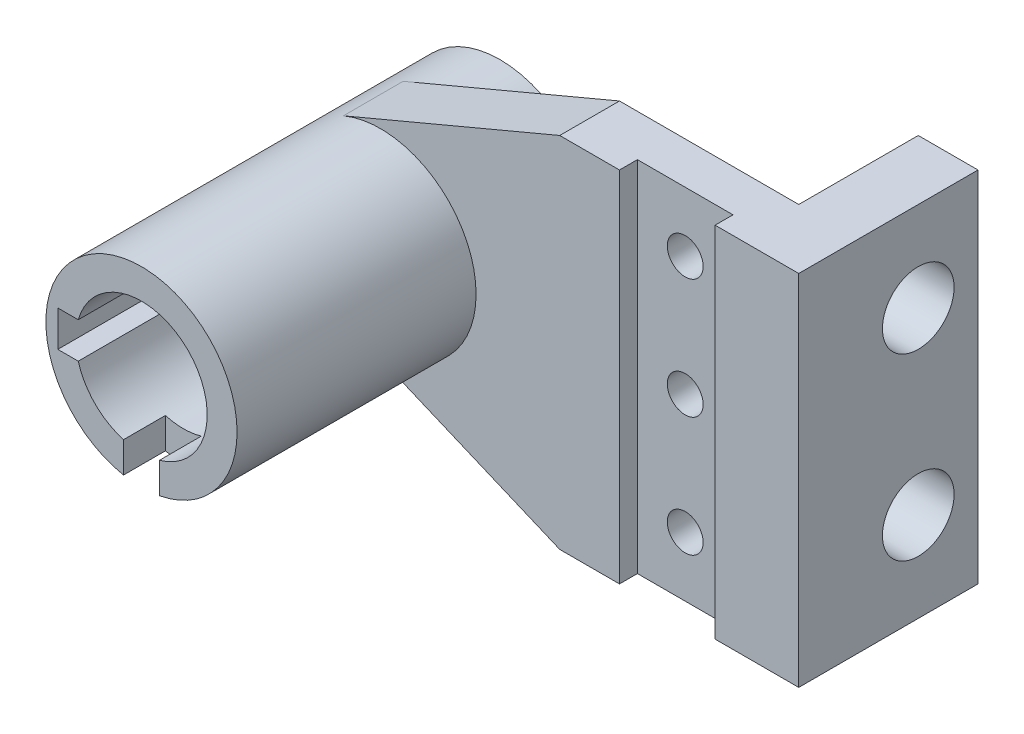
from build123d import *

# Parameters (mm, degrees)
SKETCH2_R                = 3
BOSS_EXTRUDE1_DEPTH      = 10
SKETCH2_5_R              = 3
CUT_EXTRUDE1_DEPTH       = 3
BOSS_EXTRUDE2_DEPTH      = 40
BOSS_EXTRUDE2_DEPTH_BACK = 20
SKETCH3_W                = 30
SKETCH3_H                = 20
SKETCH3_R                = 6
BOSS_EXTRUDE3_DEPTH      = 10
CUT_EXTRUDE2_START       = -7
CUT_EXTRUDE2_DEPTH       = 7


with BuildPart() as part:
    # Sketch2 → Boss-Extrude1 (new body)
    with BuildSketch(Plane(origin=(0, 0, 0), x_dir=(0, 1, 0), z_dir=(0, 0, 1))):
        with BuildLine():
            ThreePointArc((0, -16), (-13.330167524, -8.849103559), (-14.745004109, 6.211670776))
            Line((-14.745004109, 6.211670776), (-30, -30))
            Line((-30, -30), (-30, -70))
            Line((-30, -70), (0, -70))
            Line((0, -70), (0, -51))
            ThreePointArc((0, -51), (-3, -48), (0, -45))
            Line((0, -45), (0, -16))
        make_face()
        with Locations((-20, -48)):
            Circle(SKETCH2_R, mode=Mode.SUBTRACT)
    extrude(amount=-BOSS_EXTRUDE1_DEPTH)

    # Sketch2<5> → Cut-Extrude1 (cut)
    with BuildSketch(Plane(origin=(0, 0, 0), x_dir=(0, 1, 0), z_dir=(0, 0, 1))):
        with BuildLine():
            Line((0, -40), (-30, -40))
            Line((-30, -40), (-30, -56))
            Line((-30, -56), (0, -56))
            Line((0, -56), (0, -51))
            ThreePointArc((0, -51), (-3, -48), (0, -45))
            Line((0, -45), (0, -40))
        make_face()
        with Locations((-20, -48)):
            Circle(SKETCH2_5_R, mode=Mode.SUBTRACT)
    extrude(amount=-CUT_EXTRUDE1_DEPTH, mode=Mode.SUBTRACT)

    # Sketch2<6> → Boss-Extrude2 (add, two sides: drawn at the far end of the back side and taken through both)
    with BuildSketch(Plane(origin=(0, 0, 0), x_dir=(0, 1, 0), z_dir=(0, 0, 1)).offset(-BOSS_EXTRUDE2_DEPTH_BACK)):
        with BuildLine():
            ThreePointArc((0, 16), (-8.849103559, 13.330167524), (-14.745004109, 6.211670776))
            ThreePointArc((-14.745004109, 6.211670776), (-13.330167524, -8.849103559), (0, -16))
            Line((0, -16), (0, -11))
            ThreePointArc((0, -11), (-10.895252583, -1.514421063), (-3, 10.583005244))
            Line((-3, 10.583005244), (-3, 14))
            Line((-3, 14), (0, 14))
            Line((0, 14), (0, 16))
        make_face()
    extrude(amount=BOSS_EXTRUDE2_DEPTH + BOSS_EXTRUDE2_DEPTH_BACK)

    # Sketch3 → Boss-Extrude3 (add)
    with BuildSketch(Plane.YZ.offset(70)):
        with Locations((-15, -20)):
            Rectangle(SKETCH3_W, SKETCH3_H)
        with Locations((-15, -20)):
            Circle(SKETCH3_R, mode=Mode.SUBTRACT)
    extrude(amount=-BOSS_EXTRUDE3_DEPTH)

    # Mirror1: part across plane


with BuildPart() as part_1:
    add(part.part)
    add(part.part.mirror(Plane(origin=(0, 0, -10), x_dir=(0, 0, 1), z_dir=(0, 1, 0))))

    # Sketch4 → Cut-Extrude2 (cut)
    with BuildSketch(Plane.XY.offset(40).offset(CUT_EXTRUDE2_START)):
        with BuildLine():
            ThreePointArc((3, -10.583005244), (0, -11), (-3, -10.583005244))
            Line((-3, -10.583005244), (-3, -15.716233646))
            ThreePointArc((-3, -15.716233646), (0, -16), (3, -15.716233646))
            Line((3, -15.716233646), (3, -10.583005244))
        make_face()
    extrude(amount=CUT_EXTRUDE2_DEPTH, mode=Mode.SUBTRACT)


solid = part_1.part
